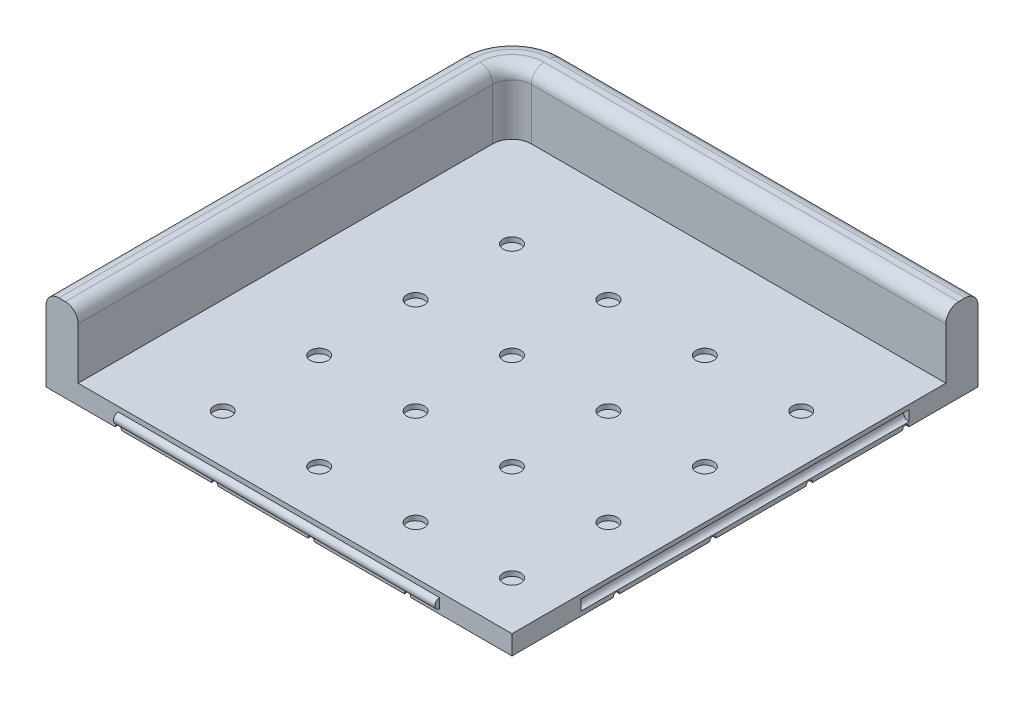
from build123d import *

# Parameters (mm, degrees)
BOSS_EXTRUDE1_DEPTH  = 6
EXTRUDE_THIN1_DEPTH  = 20
SKETCH3_R            = 2.75
CUT_EXTRUDE1_DEPTH   = 1.5
LPATTERN1_COUNT      = 4
LPATTERN1_PITCH      = 30
LPATTERN1_COUNT_DIR2 = 4
LPATTERN1_PITCH_DIR2 = 30
FILLET1_R            = 4
SKETCH4_R            = 1.5
BOSS_EXTRUDE2_DEPTH  = 50
SKETCH5_R            = 1.65
CUT_EXTRUDE2_DEPTH   = 51
SKETCH6_R            = 1
CUT_EXTRUDE3_DEPTH   = 107.809409698
LPATTERN2_COUNT      = 4
LPATTERN2_PITCH      = 30
SKETCH7_R            = 1
CUT_EXTRUDE4_DEPTH   = 107.809409698
LPATTERN3_COUNT      = 4
LPATTERN3_PITCH      = 30


with BuildPart() as part:
    # Sketch1 → Boss-Extrude1 (new body)
    with BuildSketch(Plane(origin=(0, 0, 0), x_dir=(1, 0, 0), z_dir=(0, 1, 0))):
        with BuildLine():
            Line((-56.5, 72.5), (72.5, 72.5))
            Line((72.5, 72.5), (72.5, -72.5))
            Line((72.5, -72.5), (-72.5, -72.5))
            Line((-72.5, -72.5), (-72.5, 56.5))
            ThreePointArc((-72.5, 56.5), (-67.813708499, 67.813708499), (-56.5, 72.5))
        make_face()
    extrude(amount=BOSS_EXTRUDE1_DEPTH)

    # Sketch2 → Extrude-Thin1 (add)
    with BuildSketch(Plane(origin=(0, 6, 0), x_dir=(1, 0, 0), z_dir=(0, 1, 0))):
        with BuildLine():
            Line((-72.5, -72.5), (-72.5, 56.5))
            ThreePointArc((-72.5, 56.5), (-67.813708499, 67.813708499), (-56.5, 72.5))
            Line((-56.5, 72.5), (72.5, 72.5))
            Line((72.5, 72.5), (72.5, 62.5))
            Line((72.5, 62.5), (-56.5, 62.5))
            ThreePointArc((-56.5, 62.5), (-60.742640687, 60.742640687), (-62.5, 56.5))
            Line((-62.5, 56.5), (-62.5, -72.5))
            Line((-62.5, -72.5), (-72.5, -72.5))
        make_face()
    extrude(amount=EXTRUDE_THIN1_DEPTH)

    # Sketch3 → Cut-Extrude1 (cut)
    with BuildSketch(Plane(origin=(0, 6, 0), x_dir=(1, 0, 0), z_dir=(0, 1, 0))):
        with Locations(Location((57.5, -57.5, 0), (0, 0, 270))):
            Circle(SKETCH3_R)
    cut_extrude1 = extrude(amount=-CUT_EXTRUDE1_DEPTH, mode=Mode.SUBTRACT)

    # LPattern1: Cut-Extrude1 4 × 4
    with Locations(*[(-i * LPATTERN1_PITCH, 0, -j * LPATTERN1_PITCH_DIR2) for i in range(LPATTERN1_COUNT) for j in range(LPATTERN1_COUNT_DIR2) if (i, j) != (0, 0)]):
        add(cut_extrude1, mode=Mode.SUBTRACT)

    # Fillet1
    fillet1_edges = [part.edges().sort_by_distance(p)[0] for p in [
        (8, 26, -72.5),
        (-67.813708499, 26, -67.813708499),
        (-72.5, 26, 8),
        (8, 26, -62.5),
        (-62.5, 26, 8),
        (-60.742640687, 26, -60.742640687),
    ]]
    fillet(fillet1_edges, radius=FILLET1_R)

    # Sketch4 → Boss-Extrude2 (add, symmetric)
    with BuildSketch(Plane(origin=(0, 0, 0), x_dir=(0, 0, -1), z_dir=(1, 0, 0))):
        with Locations((-72.5, 3)):
            Circle(SKETCH4_R)
    extrude(amount=BOSS_EXTRUDE2_DEPTH, both=True)

    # Sketch5 → Cut-Extrude2 (cut, symmetric)
    with BuildSketch(Plane.XY):
        with Locations((72.5, 3)):
            Circle(SKETCH5_R)
    extrude(amount=CUT_EXTRUDE2_DEPTH, both=True, mode=Mode.SUBTRACT)

    # Sketch6 → Cut-Extrude3 (cut, symmetric)
    with BuildSketch(Plane.XY):
        with Locations((-50, 0)):
            Circle(SKETCH6_R)
    cut_extrude3 = extrude(amount=CUT_EXTRUDE3_DEPTH, both=True, mode=Mode.SUBTRACT)

    # LPattern2: Cut-Extrude3 ×4
    with Locations(*[(i * LPATTERN2_PITCH, 0, 0) for i in range(1, LPATTERN2_COUNT)]):
        add(cut_extrude3, mode=Mode.SUBTRACT)

    # Sketch7 → Cut-Extrude4 (cut, symmetric)
    with BuildSketch(Plane(origin=(0, 0, 0), x_dir=(0, 0, -1), z_dir=(1, 0, 0))):
        with Locations((50, 0)):
            Circle(SKETCH7_R)
    cut_extrude4 = extrude(amount=CUT_EXTRUDE4_DEPTH, both=True, mode=Mode.SUBTRACT)

    # LPattern3: Cut-Extrude4 ×4
    with Locations(*[(0, 0, i * LPATTERN3_PITCH) for i in range(1, LPATTERN3_COUNT)]):
        add(cut_extrude4, mode=Mode.SUBTRACT)


solid = part.part
